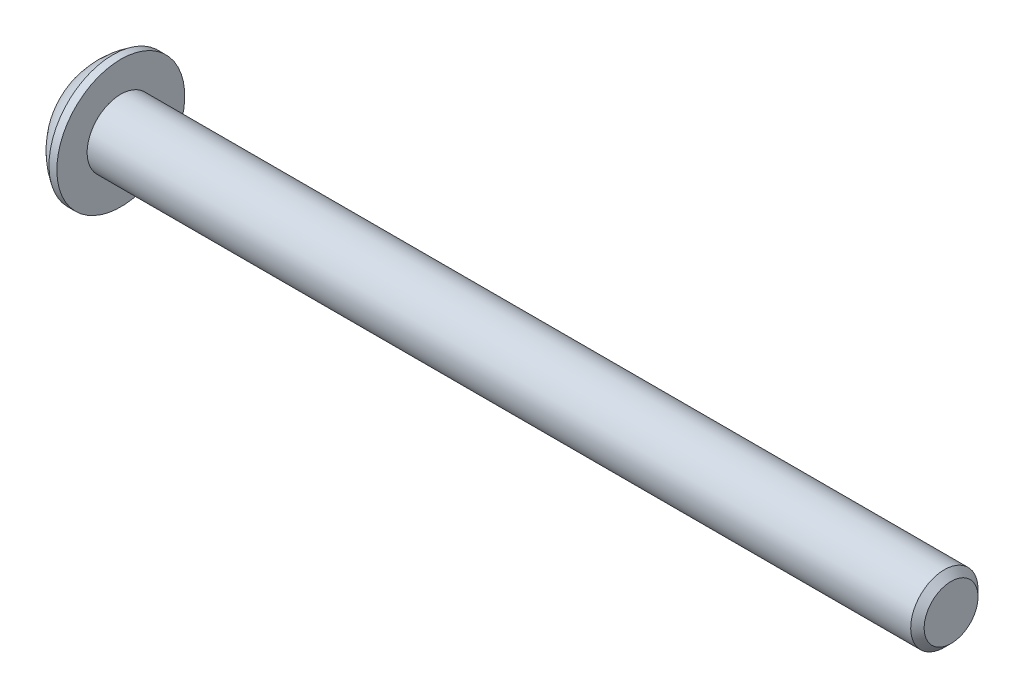
from build123d import *

# Parameters (mm, degrees)
CHAMFER1_SIZE      = 0.3
CUT_EXTRUDE1_DEPTH = 1


with BuildPart() as part:
    # Sketch1 → Revolve1 (revolve)
    with BuildSketch(Plane.XY):
        with BuildLine():
            Line((38.65, 0), (0, 0))
            Line((0, 0), (0, 1.425))
            ThreePointArc((0, 1.425), (0.549895392, 2.228823502), (1.3, 2.85))
            Line((1.3, 2.85), (1.65, 2.85))
            Line((1.65, 2.85), (1.65, 1.5))
            Line((1.65, 1.5), (38.65, 1.5))
            Line((38.65, 1.5), (38.65, 0))
        make_face()
    revolve(axis=Axis((38.65, 0, 0), (-1, 0, 0)))

    # Chamfer1
    chamfer1_edges = [part.edges().sort_by_distance(p)[0] for p in [
        (38.65, -1.5, 0),
    ]]
    chamfer(chamfer1_edges, length=CHAMFER1_SIZE)

    # Sketch2 → Cut-Extrude1 (cut)
    with BuildSketch(Plane.ZY):
        Polygon((0, 1.154700538), (-1, 0.577350269), (-1, -0.577350269), (0, -1.154700538), (1, -0.577350269), (1, 0.577350269), align=None)
    extrude(amount=-CUT_EXTRUDE1_DEPTH, mode=Mode.SUBTRACT)


solid = part.part
